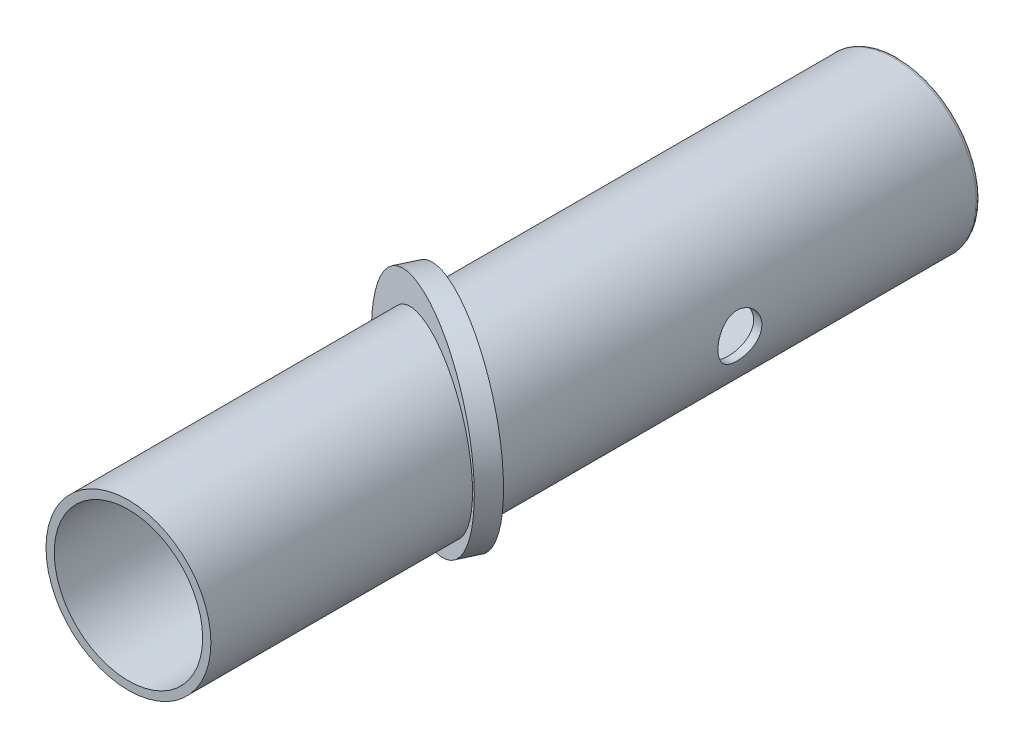
from build123d import *

# Parameters (mm, degrees)
SKETCH1_R           = 7.5
SKETCH1_R_2         = 6.75
BOSS_EXTRUDE1_DEPTH = 70
FILLET2_R           = 0.37
SKETCH8_R           = 9.678517052
BOSS_EXTRUDE6_DEPTH = 2
SKETCH9_R           = 6.75
CUT_EXTRUDE2_DEPTH  = 72
SKETCH10_R          = 2
CUT_EXTRUDE3_DEPTH  = 10


with BuildPart() as part:
    # Sketch1 → Boss-Extrude1 (new body)
    with BuildSketch(Plane.XY):
        Circle(SKETCH1_R)
        Circle(SKETCH1_R_2, mode=Mode.SUBTRACT)
    extrude(amount=BOSS_EXTRUDE1_DEPTH)

    # Fillet2
    fillet2_edges = [part.edges().sort_by_distance(p)[0] for p in [
        (-7.5, 0, 0),
        (-6.75, 0, 0),
    ]]
    fillet(fillet2_edges, radius=FILLET2_R)

    # Sketch8 → Boss-Extrude6 (add)
    with BuildSketch(Plane(origin=(-15.511368661, 0, 33.264237441), x_dir=(0, -1, 0), z_dir=(-0.4226182617407003, 0, 0.9063077870366496))):
        with Locations(Location((0, 16.981195542, 0), (0, 0, 90))):
            Circle(SKETCH8_R)
    extrude(amount=BOSS_EXTRUDE6_DEPTH)

    # Sketch9 → Cut-Extrude2 (cut)
    with BuildSketch(Plane.XY):
        Circle(SKETCH9_R)
    extrude(amount=CUT_EXTRUDE2_DEPTH, mode=Mode.SUBTRACT)

    # Sketch10 → Cut-Extrude3 (cut)
    with BuildSketch(Plane(origin=(0, 0, 0), x_dir=(0, 0, -1), z_dir=(1, 0, 0))):
        with Locations(Location((-21.875209452, 0, 0), (0, 0, 180))):
            Circle(SKETCH10_R)
    extrude(amount=CUT_EXTRUDE3_DEPTH, mode=Mode.SUBTRACT)


solid = part.part
